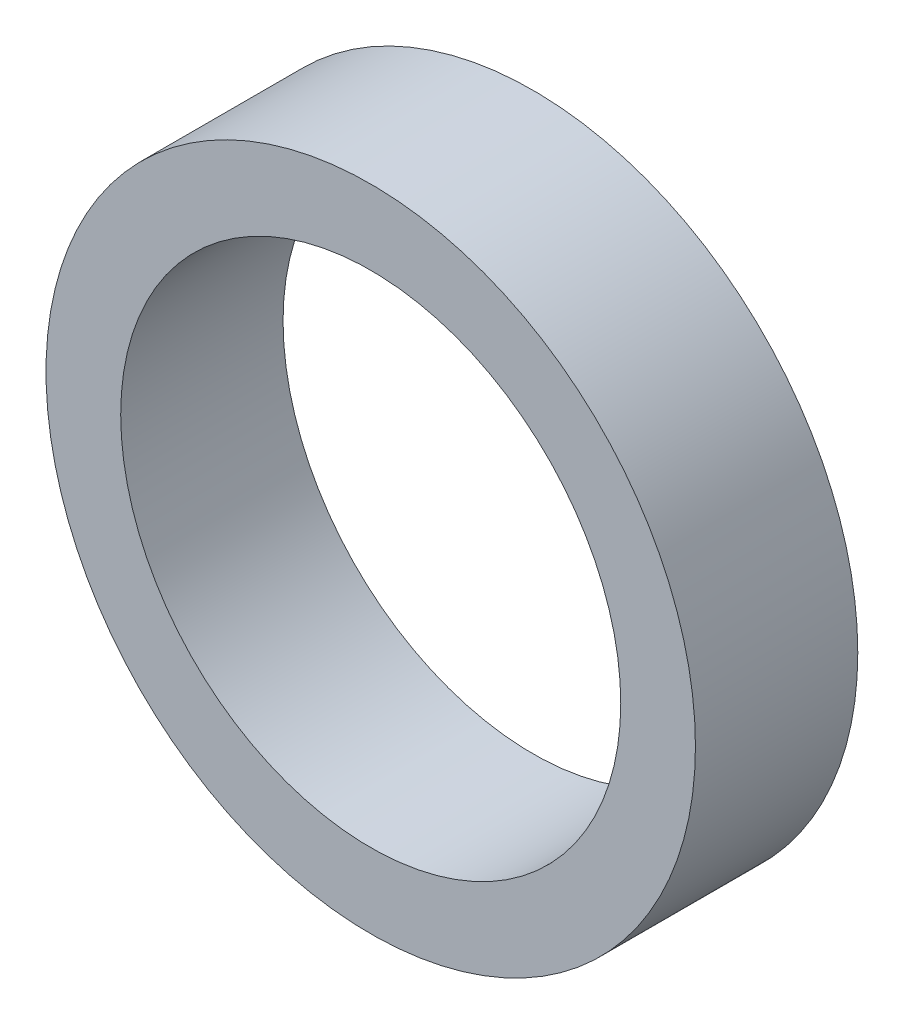
from build123d import *

# Parameters (mm, degrees)
SKETCH1_R           = 10
SKETCH1_R_2         = 7.7
BOSS_EXTRUDE1_DEPTH = 5


with BuildPart() as part:
    # Sketch1 → Boss-Extrude1 (new body)
    with BuildSketch(Plane.XY):
        Circle(SKETCH1_R)
        Circle(SKETCH1_R_2, mode=Mode.SUBTRACT)
    extrude(amount=BOSS_EXTRUDE1_DEPTH)


solid = part.part
